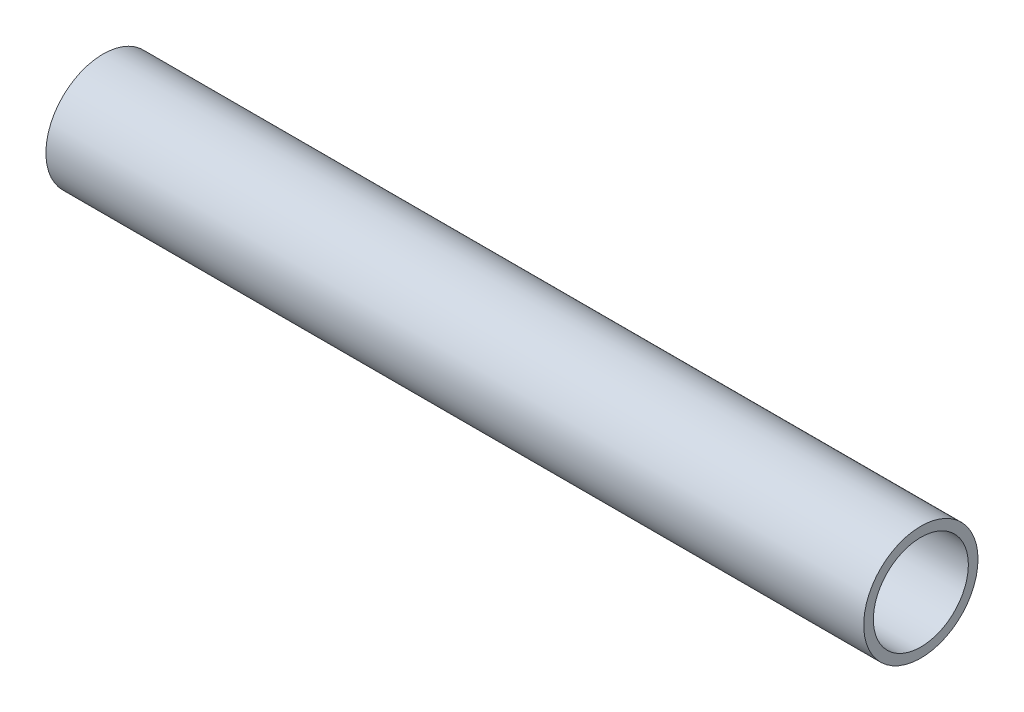
from build123d import *

# Parameters (mm, degrees)
BOSS_EXTRUDE1_DEPTH      = 127
BOSS_EXTRUDE1_DEPTH_BACK = 174.625
SKETCH1_R                = 21.082
SKETCH1_R_2              = 17.526
SKETCH2_R                = 3.175
CUT_EXTRUDE1_DEPTH       = 178.151889838


with BuildPart() as part:
    # Sketch1 → Boss-Extrude1 (new, two sides: drawn at the far end of the back side and taken through both)
    with BuildSketch(Plane(origin=(0, 0, 0), x_dir=(0, 0, -1), z_dir=(1, 0, 0)).offset(-BOSS_EXTRUDE1_DEPTH_BACK)):
        Circle(SKETCH1_R)
        Circle(SKETCH1_R_2, mode=Mode.SUBTRACT)
    extrude(amount=BOSS_EXTRUDE1_DEPTH + BOSS_EXTRUDE1_DEPTH_BACK)

    # Sketch2 → Cut-Extrude1 (cut, through all)
    with BuildSketch(Plane.XY):
        with Locations((-98.425, 0)):
            Circle(SKETCH2_R)
        with Locations((-149.225, 0)):
            Circle(SKETCH2_R)
    extrude(amount=-CUT_EXTRUDE1_DEPTH, mode=Mode.SUBTRACT)


solid = part.part
